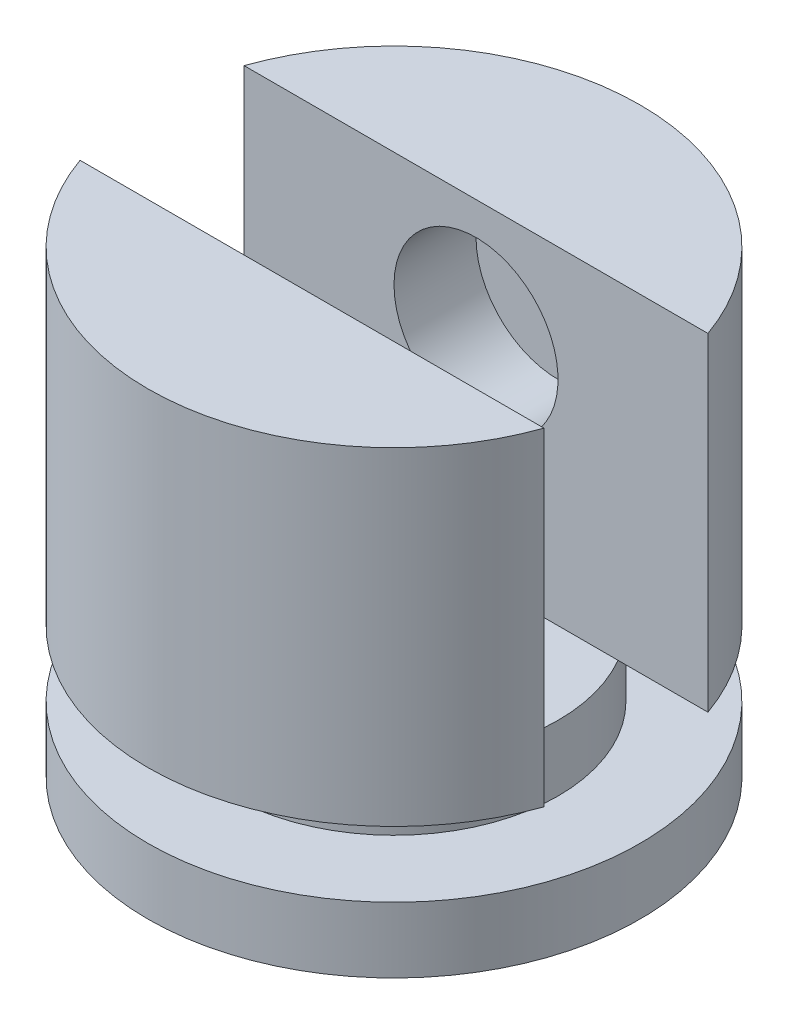
from build123d import *

# Parameters (mm, degrees)
SKETCH1_R           = 10
BOSS_EXTRUDE1_DEPTH = 4
SKETCH2_R           = 15
BOSS_EXTRUDE2_DEPTH = 4
BOSS_EXTRUDE3_START = 20
SKETCH3_R           = 15
BOSS_EXTRUDE3_DEPTH = 20
SKETCH6_W           = 30
SKETCH6_H           = 5
CUT_EXTRUDE2_DEPTH  = 30.154759474
SKETCH7_R           = 5
CUT_EXTRUDE5_DEPTH  = 5


with BuildPart() as part:
    # Sketch1 → Boss-Extrude1 (new body)
    with BuildSketch(Plane(origin=(0, 0, 0), x_dir=(1, 0, 0), z_dir=(0, 1, 0))):
        with Locations(Location((0, 0, 0), (0, 0, 270))):
            Circle(SKETCH1_R)
    extrude(amount=-BOSS_EXTRUDE1_DEPTH)

    # Sketch2 → Boss-Extrude2 (add)
    with BuildSketch(Plane.XZ.offset(4)):
        with Locations(Location((0, 0, 0), (0, 0, 270))):
            Circle(SKETCH2_R)
    extrude(amount=BOSS_EXTRUDE2_DEPTH)

    # Sketch3 → Boss-Extrude3 (add)
    with BuildSketch(Plane(origin=(0, 0, 0), x_dir=(1, 0, 0), z_dir=(0, 1, 0)).offset(BOSS_EXTRUDE3_START)):
        with Locations(Location((0, 0, 0), (0, 0, 90))):
            Circle(SKETCH3_R)
    extrude(amount=-BOSS_EXTRUDE3_DEPTH)

    # Sketch6 → Cut-Extrude2 (cut, through all)
    with BuildSketch(Plane(origin=(0, 0, 0), x_dir=(1, 0, 0), z_dir=(0, 1, 0))):
        with Locations((0, -2.5)):
            Rectangle(SKETCH6_W, SKETCH6_H)
    cut_extrude2 = extrude(amount=CUT_EXTRUDE2_DEPTH, mode=Mode.SUBTRACT)

    # Sketch7 → Cut-Extrude5 (cut)
    with BuildSketch(Plane(origin=(0, 0, 5), x_dir=(-1, 0, 0), z_dir=(0, 0, -1))):
        with Locations((0, 13)):
            Circle(SKETCH7_R)
    cut_extrude5 = extrude(amount=-CUT_EXTRUDE5_DEPTH, mode=Mode.SUBTRACT)

    # Mirror1: Cut-Extrude2, Cut-Extrude5 across plane
    add(cut_extrude2.mirror(Plane.XY), mode=Mode.SUBTRACT)
    add(cut_extrude5.mirror(Plane.XY), mode=Mode.SUBTRACT)


solid = part.part
